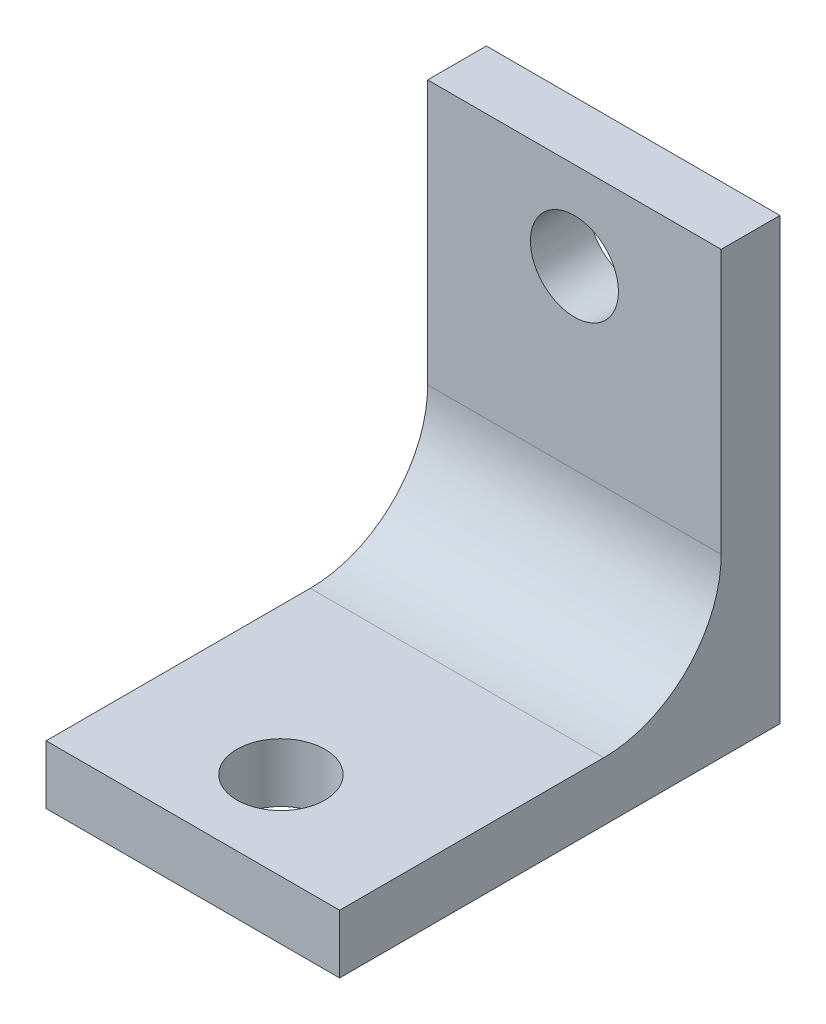
from build123d import *

# Parameters (mm, degrees)
BOSS_EXTRUDE1_DEPTH = 10
SKETCH2_R           = 1.5
CUT_EXTRUDE1_DEPTH  = 10
SKETCH3_R           = 1.5
CUT_EXTRUDE2_DEPTH  = 10
FILLET1_R           = 4


with BuildPart() as part:
    # Sketch1 → Boss-Extrude1 (new body)
    with BuildSketch(Plane(origin=(0, 0, 0), x_dir=(0, 0, -1), z_dir=(1, 0, 0))):
        Polygon((0, 0), (0, 15), (-2, 15), (-2, 2), (-15, 2), (-15, 0), align=None)
    extrude(amount=BOSS_EXTRUDE1_DEPTH)

    # Sketch2 → Cut-Extrude1 (cut)
    with BuildSketch(Plane.XY.offset(2)):
        with Locations((5, 12)):
            Circle(SKETCH2_R)
    extrude(amount=-CUT_EXTRUDE1_DEPTH, mode=Mode.SUBTRACT)

    # Sketch3 → Cut-Extrude2 (cut)
    with BuildSketch(Plane(origin=(0, 2, 0), x_dir=(1, 0, 0), z_dir=(0, 1, 0))):
        with Locations(Location((5, -12, 0), (0, 0, 270))):
            Circle(SKETCH3_R)
    extrude(amount=-CUT_EXTRUDE2_DEPTH, mode=Mode.SUBTRACT)

    # Fillet1
    fillet1_edges = [part.edges().sort_by_distance(p)[0] for p in [
        (5, 2, 2),
    ]]
    fillet(fillet1_edges, radius=FILLET1_R)


solid = part.part
